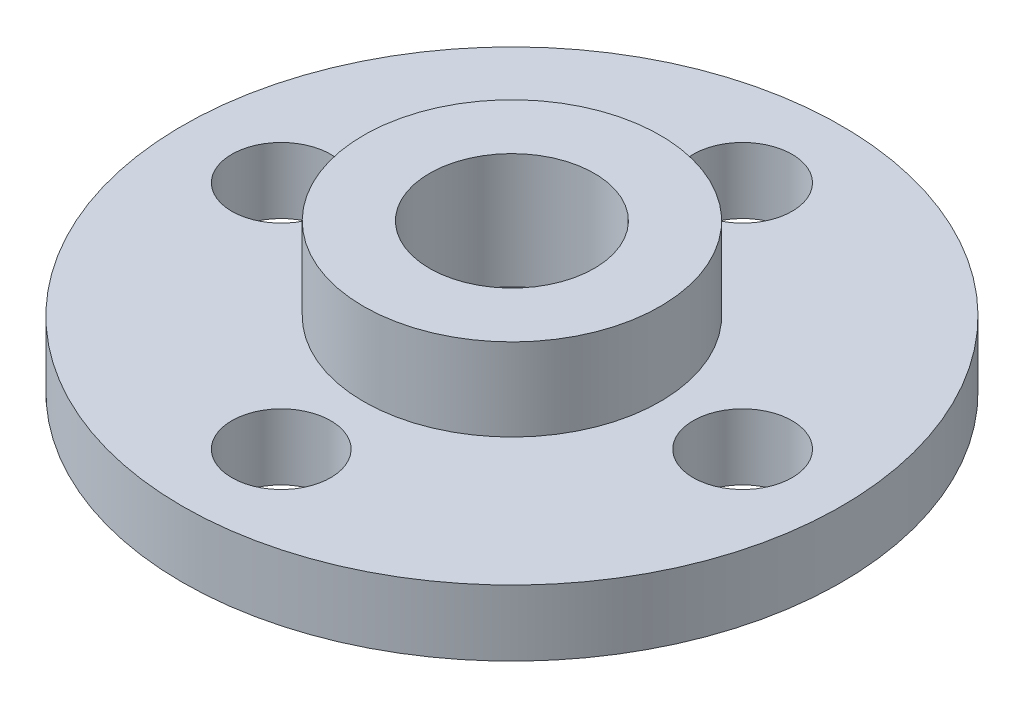
from build123d import *

# Parameters (mm, degrees)
SKETCH_1_R          = 10
SKETCH_1_R_2        = 1.5
EXTRUDE_1_DEPTH     = 2
SKETCH_2_R          = 4.5
EXTRUDE_2_DEPTH     = 2.5
SKETCH_3_R          = 1.5
CUT_EXTRUDE_1_DEPTH = 15.84082208
SKETCH_4_R          = 2.5
CUT_EXTRUDE_2_DEPTH = 3.5


with BuildPart() as part:
    # 草图1 → 凸台-拉伸1 (new body)
    with BuildSketch(Plane(origin=(0, 0, 0), x_dir=(1, 0, 0), z_dir=(0, 1, 0))):
        with Locations(Location((0, 0, 0), (0, 0, 270))):
            Circle(SKETCH_1_R)
        with Locations(Location((0, 7, 0), (0, 0, 270))):
            Circle(SKETCH_1_R_2, mode=Mode.SUBTRACT)
        with Locations(Location((7, 0, 0), (0, 0, 270))):
            Circle(SKETCH_1_R_2, mode=Mode.SUBTRACT)
        with Locations(Location((0, -7, 0), (0, 0, 270))):
            Circle(SKETCH_1_R_2, mode=Mode.SUBTRACT)
        with Locations(Location((-7, 0, 0), (0, 0, 270))):
            Circle(SKETCH_1_R_2, mode=Mode.SUBTRACT)
    extrude(amount=EXTRUDE_1_DEPTH)

    # 草图2 → 凸台-拉伸2 (add)
    with BuildSketch(Plane(origin=(0, 2, 0), x_dir=(1, 0, 0), z_dir=(0, 1, 0))):
        with Locations(Location((0, 0, 0), (0, 0, 270))):
            Circle(SKETCH_2_R)
    extrude(amount=EXTRUDE_2_DEPTH)

    # 草图3 → 切除-拉伸1 (cut, through all)
    with BuildSketch(Plane(origin=(0, 4.5, 0), x_dir=(1, 0, 0), z_dir=(0, 1, 0))):
        with Locations(Location((0, 0, 0), (0, 0, 270))):
            Circle(SKETCH_3_R)
    extrude(amount=-CUT_EXTRUDE_1_DEPTH, mode=Mode.SUBTRACT)

    # 草图4 → 切除-拉伸2 (cut)
    with BuildSketch(Plane(origin=(0, 4.5, 0), x_dir=(1, 0, 0), z_dir=(0, 1, 0))):
        with Locations(Location((0, 0, 0), (0, 0, 270))):
            Circle(SKETCH_4_R)
    extrude(amount=-CUT_EXTRUDE_2_DEPTH, mode=Mode.SUBTRACT)


solid = part.part
